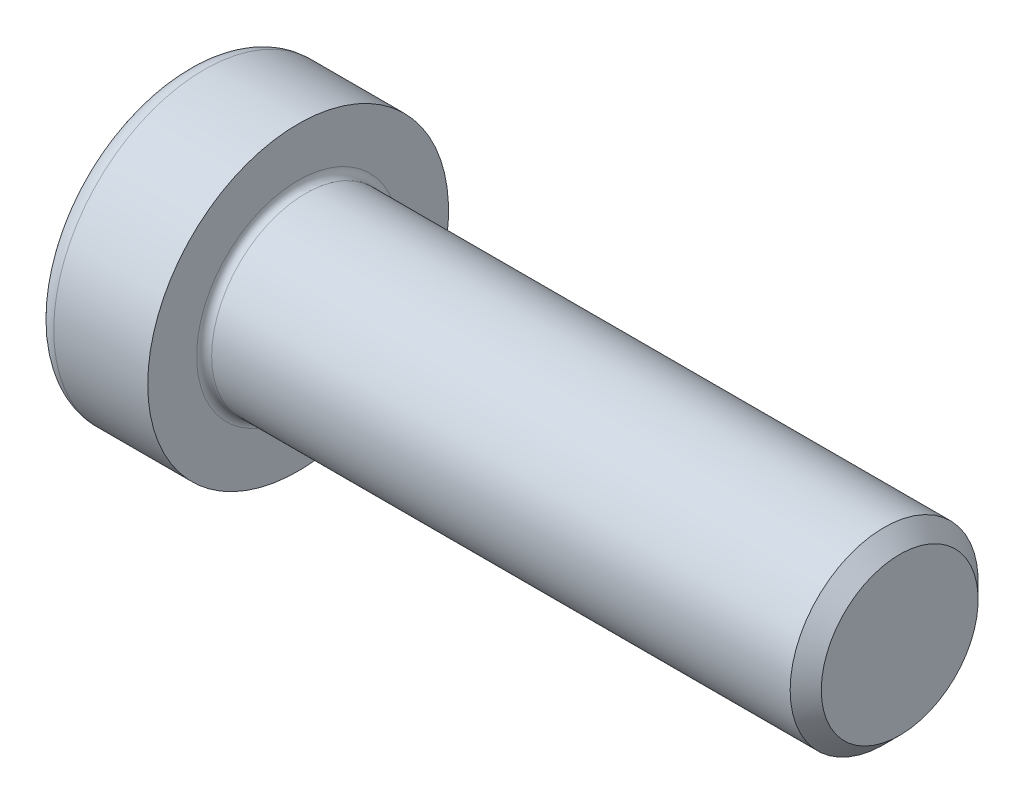
from build123d import *

# Parameters (mm, degrees)
FILLET1_R   = 0.4
FILLET2_R   = 1
HEX_2_DEPTH = 4.5


with BuildPart() as part:
    # BodySke → Base-Revolve (revolve)
    with BuildSketch(Plane.XY, mode=Mode.PRIVATE) as base_revolve_sk:
        Polygon((0, 0), (0, 8), (6, 8), (6, 5), (37.172, 5), (38, 4.172), (38, 0), align=None)
    revolve(base_revolve_sk.sketch.rotate(Axis((-31.75, 0, 0), (1, 0, 0)), 90), axis=Axis((-31.75, 0, 0), (1, 0, 0)))

    # Fillet1
    fillet1_edges = [part.edges().sort_by_distance(p)[0] for p in [
        (6, 0, -5),
    ]]
    fillet(fillet1_edges, radius=FILLET1_R)

    # Fillet2
    fillet2_edges = [part.edges().sort_by_distance(p)[0] for p in [
        (0, 0, -8),
    ]]
    fillet(fillet2_edges, radius=FILLET2_R)

    # Sketch2 → Hex-PreBroach (revolve, cut)
    with BuildSketch(Plane.XY, mode=Mode.PRIVATE) as hex_prebroach_sk:
        Polygon((0, 3.5), (4.5, 3.5), (6.520725942, 0), (0, 0), align=None)
    revolve(hex_prebroach_sk.sketch.rotate(Axis((0, 0, 0), (1, 0, 0)), 90), axis=Axis((0, 0, 0), (1, 0, 0)), mode=Mode.SUBTRACT)

    # Sketch3 → Hex 2 (cut)
    with BuildSketch(Plane(origin=(0, 0, 0), x_dir=(0, 0.500000000000001, 0.866025403784438), z_dir=(-1, 0, 0))):
        Polygon((2.020725942, 3.5), (-2.020725942, 3.5), (-4.041451884, 0), (-2.020725942, -3.5), (2.020725942, -3.5), (4.041451884, 0), align=None)
    extrude(amount=-HEX_2_DEPTH, mode=Mode.SUBTRACT)


solid = part.part
